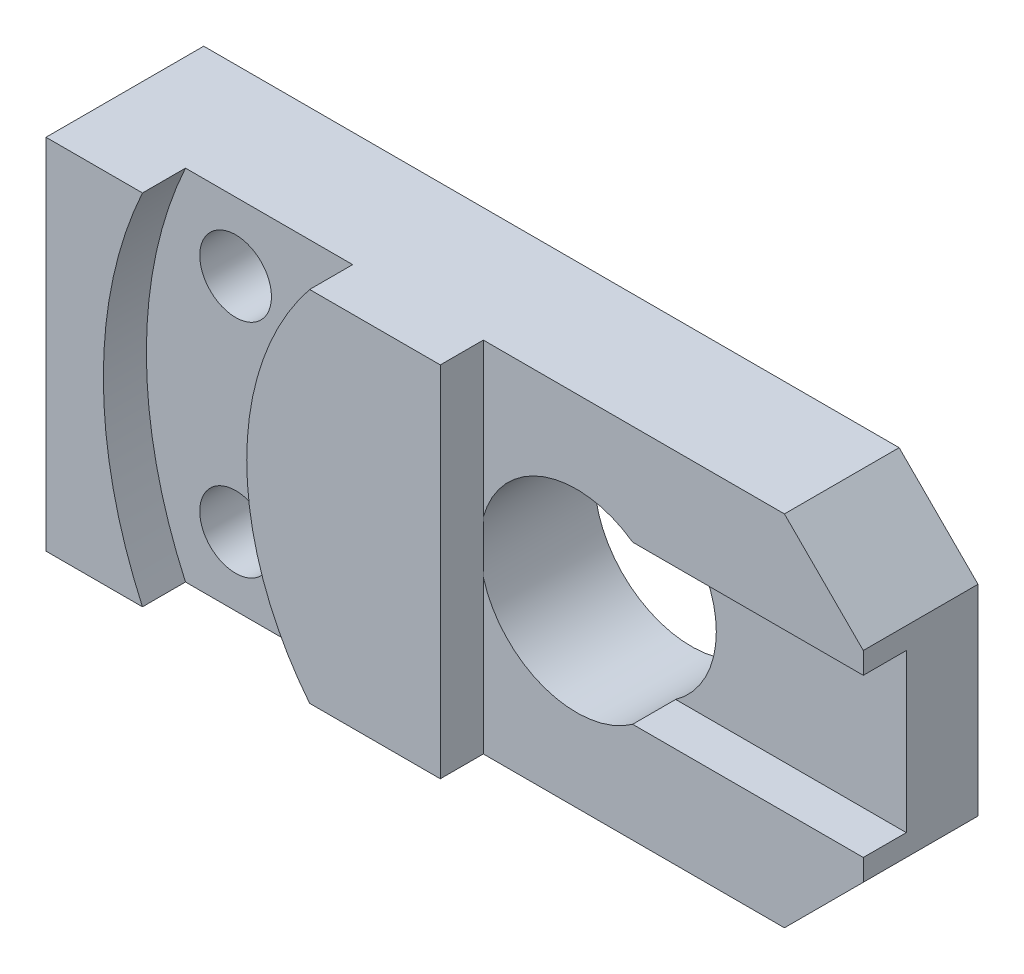
from build123d import *

# Parameters (mm, degrees)
SKETCH1_W           = 108
SKETCH1_H           = 50
BOSS_EXTRUDE1_DEPTH = 22
SKETCH2_W           = 53
SKETCH2_H           = 50
CUT_EXTRUDE1_DEPTH  = 6
CUT_EXTRUDE2_REACH  = 63.62
SKETCH3_R           = 13.5
SKETCH4_W           = 40
SKETCH4_H           = 22
CUT_EXTRUDE3_DEPTH  = 6
CHAMFER1_SIZE       = 11
CUT_EXTRUDE4_REACH  = 63.62
SKETCH5_R           = 5


with BuildPart() as part:
    # Sketch1 → Boss-Extrude1 (new body)
    with BuildSketch(Plane.XY):
        Rectangle(SKETCH1_W, SKETCH1_H)
    extrude(amount=BOSS_EXTRUDE1_DEPTH)

    # Sketch2 → Cut-Extrude1 (cut)
    with BuildSketch(Plane.XY.offset(22)):
        with Locations((27.5, 0)):
            Rectangle(SKETCH2_W, SKETCH2_H)
        with BuildLine():
            Line((-17.224989992, 25), (-40.543560573, 25))
            ThreePointArc((-40.543560573, 25), (-46, 0), (-40.543560573, -25))
            Line((-40.543560573, -25), (-17.224989992, -25))
            ThreePointArc((-17.224989992, -25), (-26, 0), (-17.224989992, 25))
        make_face()
    extrude(amount=-CUT_EXTRUDE1_DEPTH, mode=Mode.SUBTRACT)

    # Sketch3 → Cut-Extrude2 (cut, up to next)
    with BuildSketch(Plane.XY.offset(16), mode=Mode.PRIVATE) as cut_extrude2_sk1:
        with Locations((14, 0)):
            Circle(SKETCH3_R)
    cut_extrude2_tool1 = extrude(cut_extrude2_sk1.sketch, amount=-CUT_EXTRUDE2_REACH, mode=Mode.PRIVATE) & part.part
    add(cut_extrude2_tool1.solids().sort_by_distance((14, 0, 16))[0], mode=Mode.SUBTRACT)

    # Sketch4 → Cut-Extrude3 (cut)
    with BuildSketch(Plane.XY.offset(16)):
        with Locations((34, 0)):
            Rectangle(SKETCH4_W, SKETCH4_H)
    extrude(amount=-CUT_EXTRUDE3_DEPTH, mode=Mode.SUBTRACT)

    # Chamfer1
    chamfer1_edges = [part.edges().sort_by_distance(p)[0] for p in [
        (54, -25, 8),
        (54, 25, 8),
    ]]
    chamfer(chamfer1_edges, length=CHAMFER1_SIZE)

    # Sketch5 → Cut-Extrude4 (cut, up to next)
    with BuildSketch(Plane.XY.offset(16), mode=Mode.PRIVATE) as cut_extrude4_sk1:
        with Locations((-33.553101897, 15.45)):
            Circle(SKETCH5_R)
    cut_extrude4_tool1 = extrude(cut_extrude4_sk1.sketch, amount=-CUT_EXTRUDE4_REACH, mode=Mode.PRIVATE) & part.part
    # Sketch5 → Cut-Extrude4 (cut, up to next)
    with BuildSketch(Plane.XY.offset(16), mode=Mode.PRIVATE) as cut_extrude4_sk2:
        with Locations((-33.553101897, -15.45)):
            Circle(SKETCH5_R)
    cut_extrude4_tool2 = extrude(cut_extrude4_sk2.sketch, amount=-CUT_EXTRUDE4_REACH, mode=Mode.PRIVATE) & part.part
    add(cut_extrude4_tool1.solids().sort_by_distance((-33.553102, 15.45, 16))[0], mode=Mode.SUBTRACT)
    add(cut_extrude4_tool2.solids().sort_by_distance((-33.553102, -15.45, 16))[0], mode=Mode.SUBTRACT)


solid = part.part
